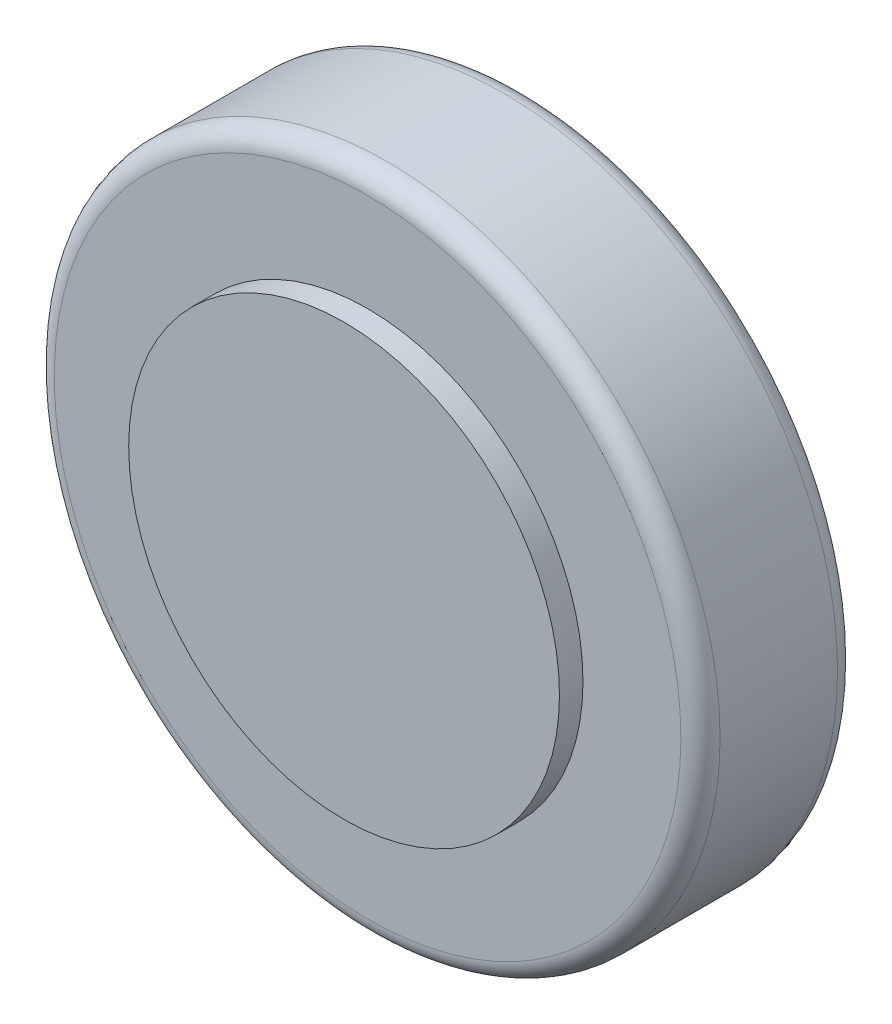
from build123d import *


with BuildPart() as part:
    # 草图1 → 旋转1 (revolve)
    with BuildSketch(Plane(origin=(0, 0, 0), x_dir=(1, 0, 0), z_dir=(0, 1, 0))):
        with BuildLine():
            Line((0, 31), (0, 26))
            Line((0, 26), (0, -26))
            Line((0, -26), (55, -26))
            Line((55, -26), (55, -20))
            Line((55, -20), (80, -20))
            ThreePointArc((80, -20), (83.535533906, -18.535533906), (85, -15))
            Line((85, -15), (85, 15))
            ThreePointArc((85, 15), (83.535533906, 18.535533906), (80, 20))
            Line((80, 20), (55, 20))
            Line((55, 20), (55, 26))
            Line((55, 26), (5, 26))
            Line((5, 26), (5, 31))
            Line((5, 31), (0, 31))
        make_face()
    revolve(axis=Axis((0, 0, -26), (0, 0, -1)))


solid = part.part
